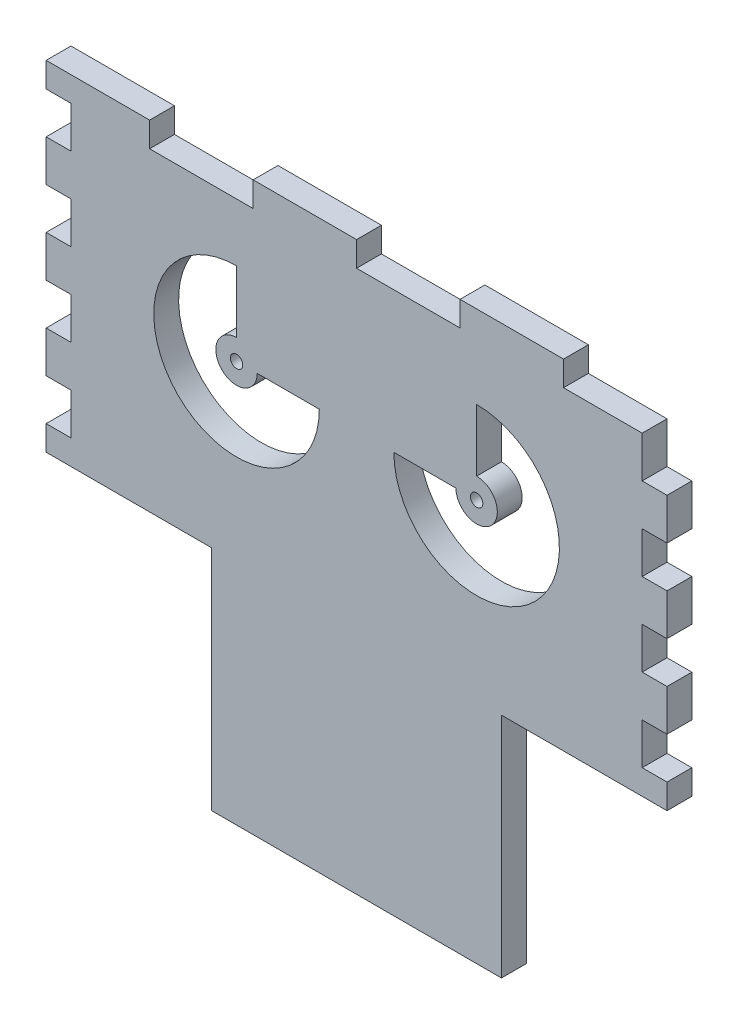
from build123d import *

# Parameters (mm, degrees)
SKETCH1_W           = 70
SKETCH1_H           = 55
SKETCH1_W_2         = 150
SKETCH1_H_2         = 82
BOSS_EXTRUDE1_DEPTH = 6
SKETCH2_W           = 6
SKETCH2_H           = 10
CUT_EXTRUDE1_DEPTH  = 10
SKETCH3_R           = 1.5
CUT_EXTRUDE2_DEPTH  = 6
SKETCH4_W           = 25
SKETCH4_H           = 6
CUT_EXTRUDE3_DEPTH  = 6


with BuildPart() as part:
    # Sketch1 → Boss-Extrude1 (new body)
    with BuildSketch(Plane.XY):
        with Locations((0, -68.5)):
            Rectangle(SKETCH1_W, SKETCH1_H)
        Rectangle(SKETCH1_W_2, SKETCH1_H_2)
    extrude(amount=BOSS_EXTRUDE1_DEPTH)

    # Sketch2 → Cut-Extrude1 (cut)
    with BuildSketch(Plane.XY.offset(6)):
        with Locations((-72, 30)):
            Rectangle(SKETCH2_W, SKETCH2_H)
        with Locations((72, 30)):
            Rectangle(SKETCH2_W, SKETCH2_H)
        with Locations((72, 10)):
            Rectangle(SKETCH2_W, SKETCH2_H)
        with Locations((-72, 10)):
            Rectangle(SKETCH2_W, SKETCH2_H)
        with Locations((-72, -10)):
            Rectangle(SKETCH2_W, SKETCH2_H)
        with Locations((72, -10)):
            Rectangle(SKETCH2_W, SKETCH2_H)
        with Locations((-72, -30)):
            Rectangle(SKETCH2_W, SKETCH2_H)
        with Locations((72, -30)):
            Rectangle(SKETCH2_W, SKETCH2_H)
    extrude(amount=-CUT_EXTRUDE1_DEPTH, mode=Mode.SUBTRACT)

    # Sketch3 → Cut-Extrude2 (cut)
    with BuildSketch(Plane.XY.offset(6)):
        with Locations((-29, 1)):
            Circle(SKETCH3_R)
        with Locations(Location((29, 1, 0), (0, 0, 180))):
            Circle(SKETCH3_R)
        with BuildLine():
            Line((-9, 1), (-24, 1))
            ThreePointArc((-24, 1), (-32.535533906, -2.535533906), (-29, 6))
            Line((-29, 6), (-29, 21))
            ThreePointArc((-29, 21), (-43.142135624, -13.142135624), (-9, 1))
        make_face()
        with BuildLine():
            Line((9, 1), (24, 1))
            ThreePointArc((24, 1), (32.535533906, -2.535533906), (29, 6))
            Line((29, 6), (29, 21))
            ThreePointArc((29, 21), (43.142135624, -13.142135624), (9, 1))
        make_face()
    extrude(amount=-CUT_EXTRUDE2_DEPTH, mode=Mode.SUBTRACT)

    # Sketch4 → Cut-Extrude3 (cut)
    with BuildSketch(Plane.XY.offset(6)):
        with Locations((12.5, 38)):
            Rectangle(SKETCH4_W, SKETCH4_H)
        with Locations((62.5, 38)):
            Rectangle(SKETCH4_W, SKETCH4_H)
        with Locations((-37.5, 38)):
            Rectangle(SKETCH4_W, SKETCH4_H)
    extrude(amount=-CUT_EXTRUDE3_DEPTH, mode=Mode.SUBTRACT)


solid = part.part
